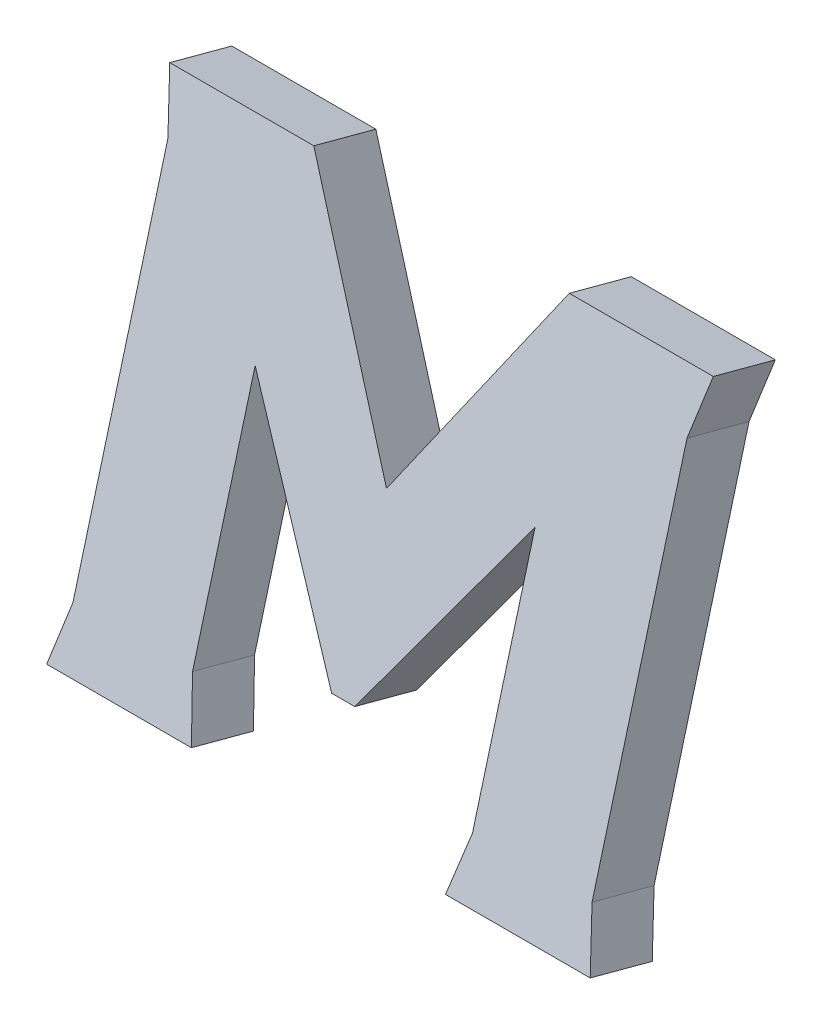
from build123d import *

# Parameters (mm, degrees)
BOSS_EXTRUDE1_DEPTH = 30


with BuildPart() as part:
    # Sketch8 → Boss-Extrude1 (new body)
    with BuildSketch(Plane(origin=(0, 0, 0), x_dir=(1, 0, 0), z_dir=(0, 0.25881904510251796, 0.9659258262890691))):
        Polygon((5.712916022, 25.390593035), (-3.978e-06, -6.965e-06), (67.605916022, -0.000406965), (61.572356022, 25.390193035), (61.571916022, 138.379593035), (121.557916022, 44.751593035), (132.350916022, 44.751593035), (192.332416022, 138.379593035), (192.332416022, 25.390593035), (186.303026022, -6.965e-06), (253.905816022, -0.000406965), (248.193306022, 25.390193035), (248.193276022, 196.777593035), (253.905786022, 222.167793035), (186.619416022, 222.167593035), (126.954316022, 122.828493035), (67.285016022, 222.167593035), (-8.3978e-05, 222.167593035), (5.712836022, 196.777393035), align=None)
    extrude(amount=BOSS_EXTRUDE1_DEPTH)


solid = part.part
